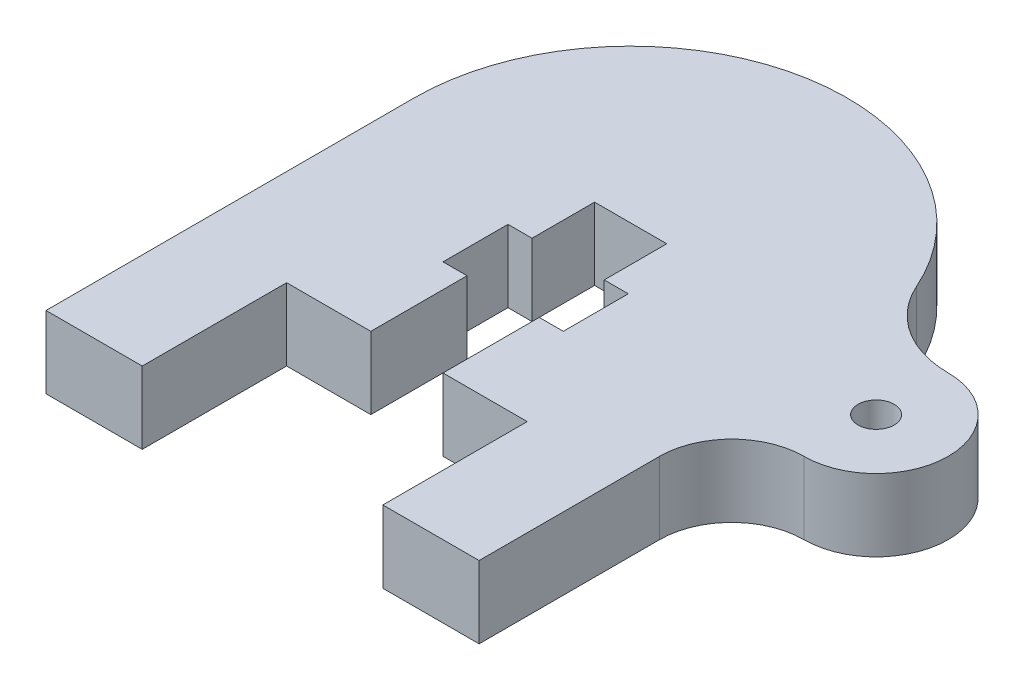
from build123d import *

# Parameters (mm, degrees)
SKETCH_1_R      = 0.75
EXTRUDE_1_DEPTH = 3


with BuildPart() as part:
    # 草图1 → 凸台-拉伸1 (new body)
    with BuildSketch(Plane(origin=(0, 0, 0), x_dir=(1, 0, 0), z_dir=(0, 1, 0))):
        with BuildLine():
            Line((-41.303773208, 8.184389917), (-41.303773208, -7.115610083))
            Line((-41.303773208, -7.115610083), (-37.303773208, -7.115610083))
            Line((-37.303773208, -7.115610083), (-37.303773208, -1.115610083))
            Line((-37.303773208, -1.115610083), (-33.803773208, -1.115610083))
            Line((-33.803773208, -1.115610083), (-33.803773208, 2.884389917))
            Line((-33.803773208, 2.884389917), (-34.803773208, 2.884389917))
            Line((-34.803773208, 2.884389917), (-34.803773208, 5.584389917))
            Line((-34.803773208, 5.584389917), (-33.803773208, 5.584389917))
            Line((-33.803773208, 5.584389917), (-33.803773208, 8.184389917))
            Line((-33.803773208, 8.184389917), (-30.803773208, 8.184389917))
            Line((-30.803773208, 8.184389917), (-30.803773208, 5.584389917))
            Line((-30.803773208, 5.584389917), (-29.803773208, 5.584389917))
            Line((-29.803773208, 5.584389917), (-29.803773208, 2.884389917))
            Line((-29.803773208, 2.884389917), (-30.803773208, 2.884389917))
            Line((-30.803773208, 2.884389917), (-30.803773208, -1.115610083))
            Line((-30.803773208, -1.115610083), (-27.303773208, -1.115610083))
            Line((-27.303773208, -1.115610083), (-27.303773208, -7.115610083))
            Line((-27.303773208, -7.115610083), (-23.303773208, -7.115610083))
            Line((-23.303773208, -7.115610083), (-23.303773208, 0.384389917))
            ThreePointArc((-23.303773208, 0.384389917), (-22.425093551, 2.505710261), (-20.303773208, 3.384389917))
            ThreePointArc((-20.303773208, 3.384389917), (-17.303773208, 6.384389917), (-20.303773208, 9.384389917))
            ThreePointArc((-20.303773208, 9.384389917), (-22.554994318, 10.051742056), (-24.078817144, 11.838168476))
            ThreePointArc((-24.078817144, 11.838168476), (-34.171311083, 16.988497043), (-41.303773208, 8.184389917))
        make_face()
        with Locations(Location((-20.303773208, 6.384389917, 0), (0, 0, 270))):
            Circle(SKETCH_1_R, mode=Mode.SUBTRACT)
    extrude(amount=EXTRUDE_1_DEPTH)


solid = part.part
